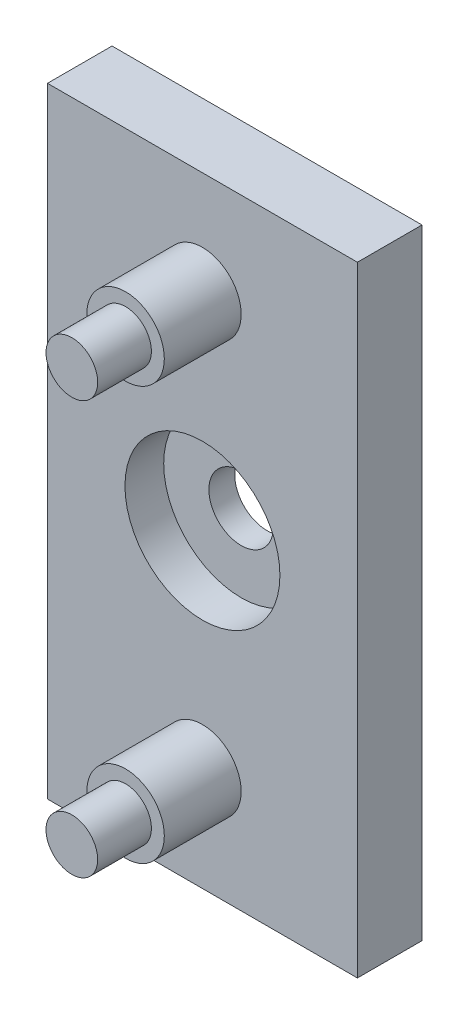
from build123d import *

# Parameters (mm, degrees)
SKETCH1_W           = 38.1
SKETCH1_H           = 76.2
BOSS_EXTRUDE1_DEPTH = 7.9375
SKETCH2_R           = 3.96875
CUT_EXTRUDE1_DEPTH  = 44.330317403
SKETCH4_R           = 9.525
CUT_EXTRUDE2_DEPTH  = 4.7625
SKETCH5_R           = 4.7625
BOSS_EXTRUDE2_DEPTH = 9.4488
SKETCH6_R           = 3.175
BOSS_EXTRUDE3_DEPTH = 6.604


with BuildPart() as part:
    # Sketch1 → Boss-Extrude1 (new body)
    with BuildSketch(Plane.XY):
        Rectangle(SKETCH1_W, SKETCH1_H)
    extrude(amount=BOSS_EXTRUDE1_DEPTH)

    # Sketch2 → Cut-Extrude1 (cut, through all)
    with BuildSketch(Plane.XY.offset(7.9375)):
        Circle(SKETCH2_R)
    extrude(amount=-CUT_EXTRUDE1_DEPTH, mode=Mode.SUBTRACT)

    # Sketch4 → Cut-Extrude2 (cut)
    with BuildSketch(Plane.XY.offset(7.9375)):
        Circle(SKETCH4_R)
    extrude(amount=-CUT_EXTRUDE2_DEPTH, mode=Mode.SUBTRACT)

    # Sketch5 → Boss-Extrude2 (add)
    with BuildSketch(Plane.XY.offset(7.9375)):
        with Locations(Location((0, 25.4, 0), (0, 0, 180))):
            Circle(SKETCH5_R)
    boss_extrude2 = extrude(amount=BOSS_EXTRUDE2_DEPTH)

    # Sketch6 → Boss-Extrude3 (add)
    with BuildSketch(Plane.XY.offset(17.3863)):
        with Locations(Location((0, 25.4, 0), (0, 0, 180))):
            Circle(SKETCH6_R)
    boss_extrude3 = extrude(amount=BOSS_EXTRUDE3_DEPTH)

    # Mirror1: Boss-Extrude2, Boss-Extrude3 across plane
    add(boss_extrude2.mirror(Plane.ZX))
    add(boss_extrude3.mirror(Plane.ZX))


solid = part.part
